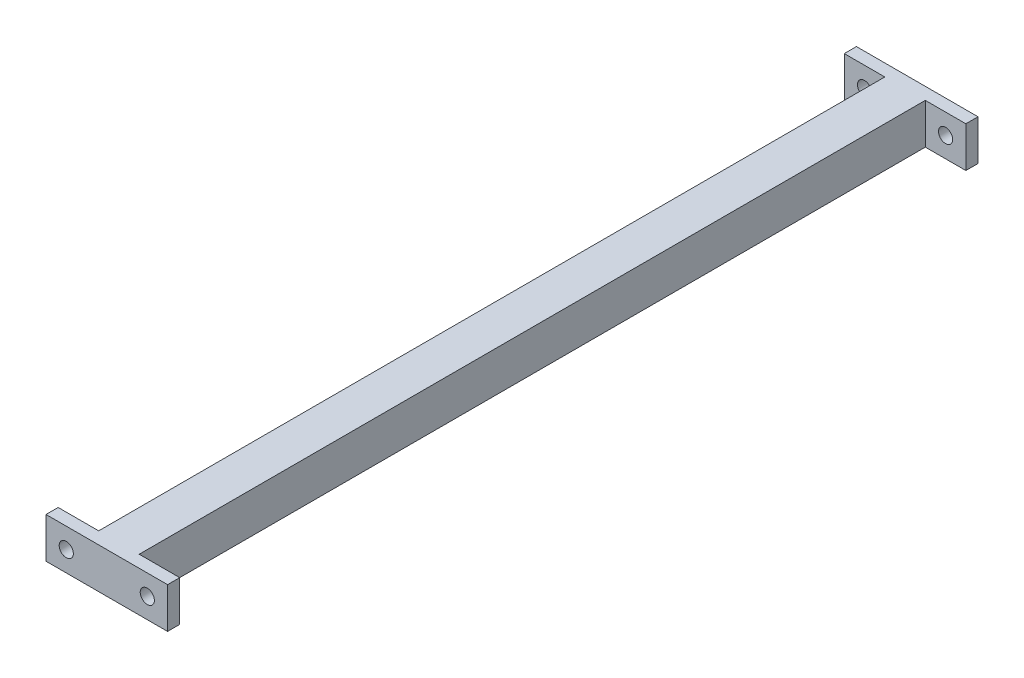
from build123d import *

# Parameters (mm, degrees)
SKETCH_1_W          = 10
SKETCH_1_H          = 10
SKETCH_1_R          = 1.75
EXTRUDE_1_DEPTH     = 200
SKETCH_2_W          = 194
SKETCH_2_H          = 10
CUT_EXTRUDE_1_DEPTH = 10
SKETCH_3_W          = 194
SKETCH_3_H          = 10
CUT_EXTRUDE_2_DEPTH = 10


with BuildPart() as part:
    # 草图1 → 凸台-拉伸1 (new body)
    # profile 1 of 3: a face of its own
    with BuildSketch(Plane.XY):
        Rectangle(SKETCH_1_W, SKETCH_1_H)
    # profile 2 of 3: a face of its own
    with BuildSketch(Plane.XY):
        with Locations((-10, 0)):
            Rectangle(SKETCH_1_W, SKETCH_1_H)
        with Locations(Location((-10, 0, 0), (0, 0, 180))):
            Circle(SKETCH_1_R, mode=Mode.SUBTRACT)
    # profile 3 of 3: a face of its own
    with BuildSketch(Plane.XY):
        with Locations((10, 0)):
            Rectangle(SKETCH_1_W, SKETCH_1_H)
        with Locations((10, 0)):
            Circle(SKETCH_1_R, mode=Mode.SUBTRACT)
    extrude(amount=EXTRUDE_1_DEPTH)

    # 草图2 → 切除-拉伸1 (cut)
    with BuildSketch(Plane(origin=(15, 0, 0), x_dir=(0, 0, -1), z_dir=(1, 0, 0))):
        with Locations((-100, 0)):
            Rectangle(SKETCH_2_W, SKETCH_2_H)
    extrude(amount=-CUT_EXTRUDE_1_DEPTH, mode=Mode.SUBTRACT)

    # 草图3 → 切除-拉伸2 (cut)
    with BuildSketch(Plane.ZY.offset(15)):
        with Locations((100, 0)):
            Rectangle(SKETCH_3_W, SKETCH_3_H)
    extrude(amount=-CUT_EXTRUDE_2_DEPTH, mode=Mode.SUBTRACT)


solid = part.part
